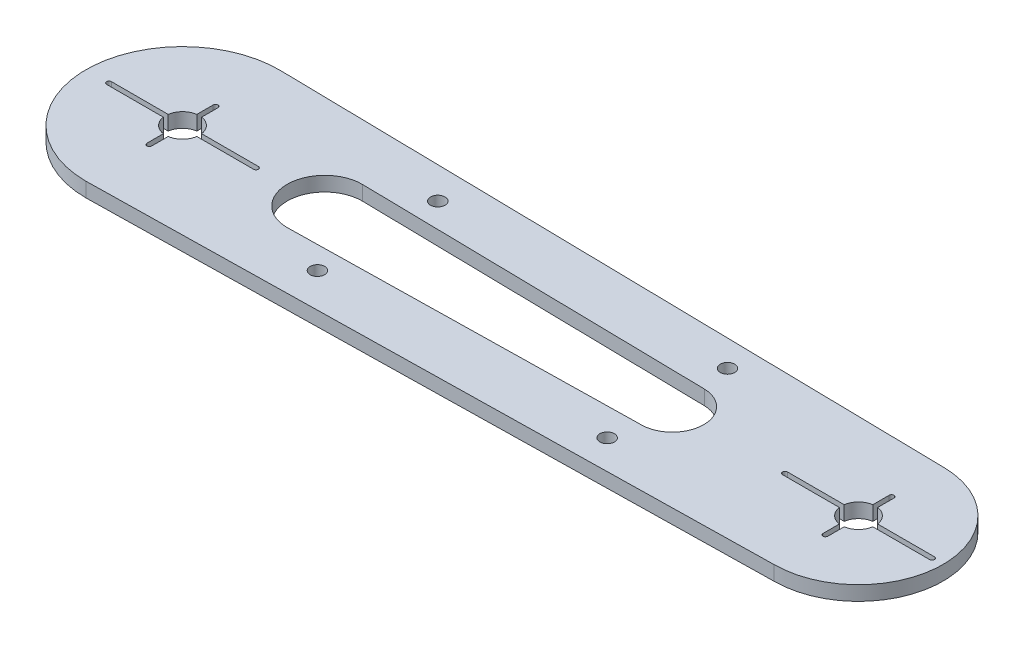
from build123d import *

# Parameters (mm, degrees)
BOSS_EXTRUDE1_DEPTH = 3
SKETCH2_R           = 3.4
SKETCH2_R_2         = 3.375
CUT_EXTRUDE1_DEPTH  = 159.793104384
CUT_EXTRUDE3_DEPTH  = 159.793104384
CUT_EXTRUDE4_DEPTH  = 159.793104384
CUT_EXTRUDE5_DEPTH  = 159.793104384
SKETCH8_R           = 3.5
CUT_EXTRUDE6_DEPTH  = 159.793104384
SKETCH10_R          = 1.5
CUT_EXTRUDE7_DEPTH  = 10


with BuildPart() as part:
    # Sketch1 → Boss-Extrude1 (new body)
    with BuildSketch(Plane(origin=(0, 0, 0), x_dir=(1, 0, 0), z_dir=(0, 1, 0))):
        with BuildLine():
            Line((140.3125, 17.497209599), (0.357142857, 19.99681097))
            ThreePointArc((0.357142857, 19.99681097), (-19.999202727, 0.178578547), (0, -20))
            Line((0, -20), (140, -17.5))
            ThreePointArc((140, -17.5), (157.499302386, -0.156256229), (140.3125, 17.497209599))
        make_face()
    extrude(amount=BOSS_EXTRUDE1_DEPTH)

    # Sketch2 → Cut-Extrude1 (cut, through all)
    with BuildSketch(Plane(origin=(0, 3, 0), x_dir=(1, 0, 0), z_dir=(0, 1, 0))):
        with Locations(Location((0, 0, 0), (0, 0, 270))):
            Circle(SKETCH2_R)
        with Locations(Location((140, 0, 0), (0, 0, 270))):
            Circle(SKETCH2_R_2)
    extrude(amount=-CUT_EXTRUDE1_DEPTH, mode=Mode.SUBTRACT)

    # Sketch4 → Cut-Extrude3 (cut, through all)
    with BuildSketch(Plane(origin=(0, 3, 0), x_dir=(1, 0, 0), z_dir=(0, 1, 0))):
        with BuildLine():
            ThreePointArc((101.494647455, -6.185682468), (107.64017994, 0.394224207), (101.283865867, 6.770744637))
            Line((101.283865867, 6.770744637), (29.173044697, 8.058643229))
            ThreePointArc((29.173044697, 8.058643229), (21.397292905, 0.29833633), (29.157599804, -7.477415462))
            Line((29.157599804, -7.477415462), (101.052392136, -6.193579885))
            Line((101.052392136, -6.193579885), (101.494647455, -6.185682468))
        make_face()
    extrude(amount=-CUT_EXTRUDE3_DEPTH, mode=Mode.SUBTRACT)

    # Sketch6 → Cut-Extrude4 (cut, through all)
    with BuildSketch(Plane(origin=(0, 0, 0), x_dir=(1, 0, 0), z_dir=(0, 1, 0))):
        with BuildLine():
            Line((-15.22, 0.5), (15.22, 0.5))
            ThreePointArc((15.22, 0.5), (15.72, 0), (15.22, -0.5))
            Line((15.22, -0.5), (-15.22, -0.5))
            ThreePointArc((-15.22, -0.5), (-15.72, 0), (-15.22, 0.5))
        make_face()
        with BuildLine():
            Line((-0.5, -6.855), (-0.5, 6.855))
            ThreePointArc((-0.5, 6.855), (0, 7.355), (0.5, 6.855))
            Line((0.5, 6.855), (0.5, -6.855))
            ThreePointArc((0.5, -6.855), (0, -7.355), (-0.5, -6.855))
        make_face()
    extrude(amount=CUT_EXTRUDE4_DEPTH, mode=Mode.SUBTRACT)

    # Sketch7 → Cut-Extrude5 (cut, through all)
    with BuildSketch(Plane(origin=(0, 3, 0), x_dir=(1, 0, 0), z_dir=(0, 1, 0))):
        with BuildLine():
            Line((155.22, -0.5), (124.78, -0.5))
            ThreePointArc((124.78, -0.5), (124.28, 0), (124.78, 0.5))
            Line((124.78, 0.5), (155.22, 0.5))
            ThreePointArc((155.22, 0.5), (155.72, 0), (155.22, -0.5))
        make_face()
        with BuildLine():
            Line((139.5, -6.855), (139.5, 6.855))
            ThreePointArc((139.5, 6.855), (140, 7.355), (140.5, 6.855))
            Line((140.5, 6.855), (140.5, -6.855))
            ThreePointArc((140.5, -6.855), (140, -7.355), (139.5, -6.855))
        make_face()
    extrude(amount=-CUT_EXTRUDE5_DEPTH, mode=Mode.SUBTRACT)

    # Sketch8 → Cut-Extrude6 (cut, through all)
    with BuildSketch(Plane(origin=(0, 3, 0), x_dir=(1, 0, 0), z_dir=(0, 1, 0))):
        Circle(SKETCH8_R)
        with Locations((140, 0)):
            Circle(SKETCH8_R)
    extrude(amount=-CUT_EXTRUDE6_DEPTH, mode=Mode.SUBTRACT)

    # Sketch10 → Cut-Extrude7 (cut)
    with BuildSketch(Plane(origin=(0, 3, 0), x_dir=(1, 0, 0), z_dir=(0, 1, 0))):
        with Locations(Location((40, 12.866071293, 0), (0, 0, 270))):
            Circle(SKETCH10_R)
        with Locations(Location((40, -12.055388552, 0), (0, 0, 270))):
            Circle(SKETCH10_R)
        with Locations(Location((100, -12.055388552, 0), (0, 0, 270))):
            Circle(SKETCH10_R)
        with Locations(Location((100, 12.866071293, 0), (0, 0, 270))):
            Circle(SKETCH10_R)
    extrude(amount=-CUT_EXTRUDE7_DEPTH, mode=Mode.SUBTRACT)


solid = part.part
